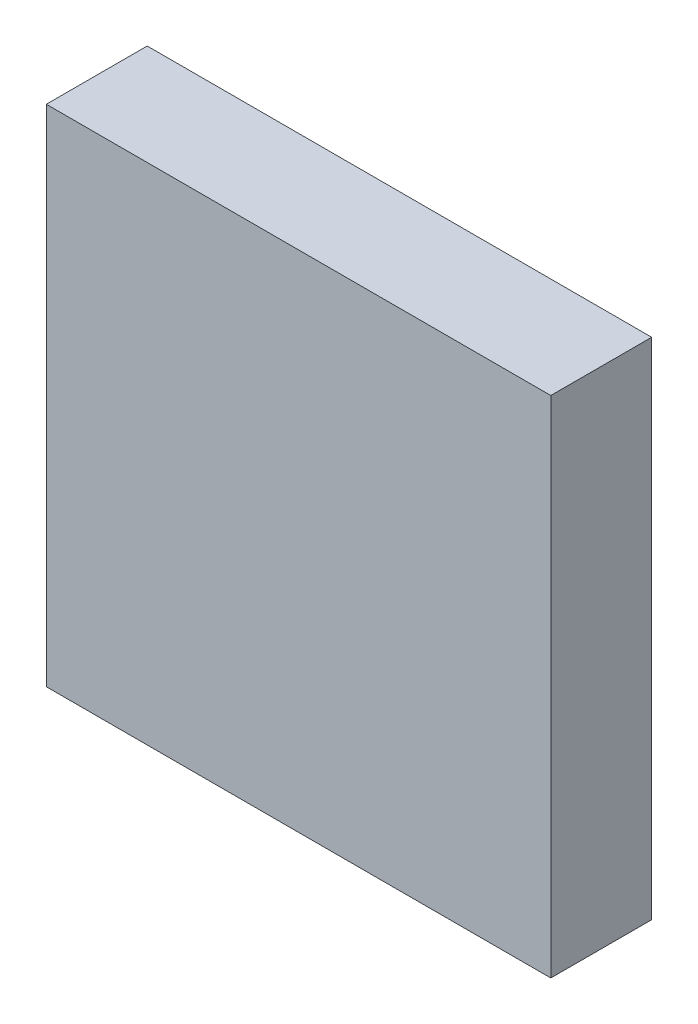
from build123d import *

# Parameters (mm, degrees)
SKETCH1_W           = 25
SKETCH1_H           = 25
BOSS_EXTRUDE1_DEPTH = 5


with BuildPart() as part:
    # Sketch1 → Boss-Extrude1 (new body)
    with BuildSketch(Plane.XY):
        with Locations((12.5, 12.5)):
            Rectangle(SKETCH1_W, SKETCH1_H)
    extrude(amount=BOSS_EXTRUDE1_DEPTH)


solid = part.part
